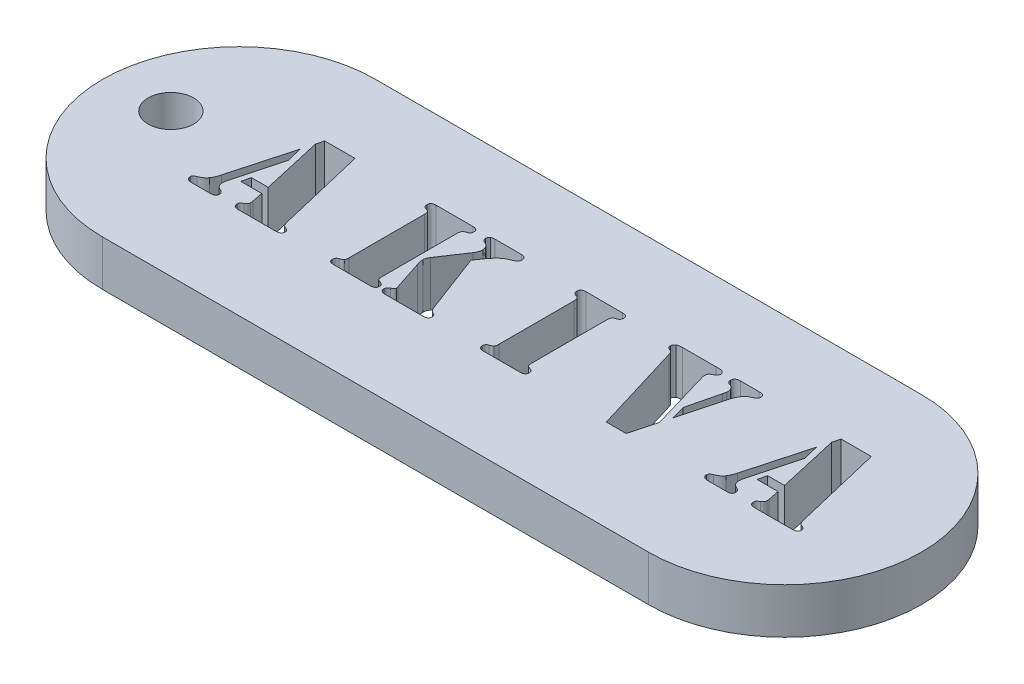
from build123d import *

# Parameters (mm, degrees)
BOSS_EXTRUDE1_DEPTH = 5
SKETCH3_R           = 2.5
CUT_EXTRUDE1_DEPTH  = 8


with BuildPart() as part:
    # Sketch2 → Boss-Extrude1 (new body)
    with BuildSketch(Plane(origin=(0, 0, 0), x_dir=(1, 0, 0), z_dir=(0, 1, 0))):
        with BuildLine():
            Line((-30, 15), (30, 15))
            ThreePointArc((30, 15), (45, 0), (30, -15))
            Line((30, -15), (-30, -15))
            ThreePointArc((-30, -15), (-45, 0), (-30, 15))
        make_face()
        with BuildLine():
            Line((-26.932759497, 6.350281331), (-23.601782799, 6.350281331))
            Line((-23.601782799, 6.350281331), (-21.287243843, -3.365883788))
            add(Edge.make_bspline(
                [(-21.287243843, -3.365883788), (-21.264912105, -3.446338159), (-21.222324973, -3.599766477), (-21.165071009, -3.748333014), (-21.137839741, -3.818994589)],
                knots=[0, 0, 0, 0, 1.048755183, 2, 2, 2, 2], degree=3))
            add(Edge.make_bspline(
                [(-21.137839741, -3.818994589), (-21.122803179, -3.845319978), (-21.091616737, -3.899919908), (-21.014786234, -3.96651677), (-20.919260528, -4.027819623), (-20.844542169, -4.059363279), (-20.804742071, -4.076165584)],
                knots=[0, 0, 0, 0, 0.840160251, 1.742526606, 2.797515595, 4, 4, 4, 4], degree=3))
            add(Edge.make_bspline(
                [(-20.804742071, -4.076165584), (-20.742307112, -4.103924345), (-20.635215601, -4.151537538), (-20.504379271, -4.245426776), (-20.429785901, -4.367373536), (-20.425127123, -4.45720289), (-20.42265945, -4.504783909)],
                knots=[0, 0, 0, 0, 1.326867952, 2.275909135, 3.086779591, 4, 4, 4, 4], degree=3))
            add(Edge.make_bspline(
                [(-20.42265945, -4.504783909), (-20.424147841, -4.53854973), (-20.427019146, -4.603688491), (-20.460199654, -4.694068209), (-20.513877044, -4.771238105), (-20.58953503, -4.833004371), (-20.686216982, -4.879449092), (-20.801972875, -4.913146059), (-20.938868308, -4.931690718), (-21.036548506, -4.934400457), (-21.08885479, -4.935851482)],
                knots=[0, 0, 0, 0, 0.899652897, 1.735550104, 2.535289427, 3.388132219, 4.315971308, 5.386976564, 6.600765056, 8, 8, 8, 8], degree=3))
            Line((-21.08885479, -4.935851482), (-25.213387701, -4.935851482))
            add(Edge.make_bspline(
                [(-25.213387701, -4.935851482), (-25.251926184, -4.934803734), (-25.326590656, -4.932773827), (-25.431223449, -4.907168495), (-25.525806297, -4.870562621), (-25.606142445, -4.817153812), (-25.67084155, -4.749945716), (-25.719122534, -4.672759288), (-25.74647422, -4.584099657), (-25.75026429, -4.52211072), (-25.752222167, -4.490088423)],
                knots=[0, 0, 0, 0, 1.175318829, 2.277063206, 3.273429624, 4.263211015, 5.198644873, 6.106027898, 7.021610334, 8, 8, 8, 8], degree=3))
            add(Edge.make_bspline(
                [(-25.752222167, -4.490088423), (-25.750675895, -4.440625607), (-25.747924115, -4.352600481), (-25.705101477, -4.249280975), (-25.646802067, -4.186049415), (-25.582902978, -4.138044978), (-25.503369054, -4.081071813), (-25.440774067, -4.046111818), (-25.406878259, -4.027180632)],
                knots=[0, 0, 0, 0, 1.432553572, 2.549404146, 3.155101411, 3.915709373, 4.871335893, 6, 6, 6, 6], degree=3))
            add(Edge.make_bspline(
                [(-25.406878259, -4.027180632), (-25.36117023, -3.999138049), (-25.278871784, -3.948646678), (-25.184031453, -3.846652831), (-25.130390411, -3.724202741), (-25.127014905, -3.635871359), (-25.125214789, -3.588765317)],
                knots=[0, 0, 0, 0, 1.161992046, 2.092195629, 2.982591342, 4, 4, 4, 4], degree=3))
            add(Edge.make_bspline(
                [(-25.125214789, -3.588765317), (-25.125558339, -3.543745341), (-25.126204688, -3.459045829), (-25.140541561, -3.375589809), (-25.147258017, -3.336492817)],
                knots=[0, 0, 0, 0, 1.063051602, 2, 2, 2, 2], degree=3))
            Line((-25.147258017, -3.336492817), (-25.387284279, -2.114318278))
            Line((-25.387284279, -2.114318278), (-27.692026244, -2.114318278))
            Line((-27.692026244, -2.114318278), (-27.469144715, -1.173807211))
            Line((-27.469144715, -1.173807211), (-25.617513551, -1.173807211))
            Line((-25.617513551, -1.173807211), (-27.138496293, 5.527334147))
            Line((-27.138496293, 5.527334147), (-26.932759497, 6.350281331))
        make_face(mode=Mode.SUBTRACT)
        with BuildLine():
            Line((-27.503434181, 4.219435943), (-27.082163599, 2.500064148))
            Line((-27.082163599, 2.500064148), (-28.510074933, -2.814803084))
            add(Edge.make_bspline(
                [(-28.510074933, -2.814803084), (-28.528006888, -2.887925643), (-28.562371161, -3.028055574), (-28.570072664, -3.172095235), (-28.57375537, -3.240972162)],
                knots=[0, 0, 0, 0, 1.043639418, 2, 2, 2, 2], degree=3))
            add(Edge.make_bspline(
                [(-28.57375537, -3.240972162), (-28.56957555, -3.321939343), (-28.561594048, -3.476548808), (-28.473000235, -3.687611761), (-28.333531468, -3.865267326), (-28.204654296, -3.941232252), (-28.137789302, -3.980644928)],
                knots=[0, 0, 0, 0, 1.065909191, 2.035388236, 2.980705811, 4, 4, 4, 4], degree=3))
            Line((-28.137789302, -3.980644928), (-27.87816906, -4.112904297))
            add(Edge.make_bspline(
                [(-27.87816906, -4.112904297), (-27.840653666, -4.135383715), (-27.769133931, -4.17823871), (-27.687944799, -4.275401643), (-27.640281262, -4.39376443), (-27.635643492, -4.479846386), (-27.633244303, -4.524377889)],
                knots=[0, 0, 0, 0, 1.03129857, 1.96607825, 2.947821365, 4, 4, 4, 4], degree=3))
            add(Edge.make_bspline(
                [(-27.633244303, -4.524377889), (-27.634019674, -4.556468693), (-27.635503415, -4.617877226), (-27.664299989, -4.702875402), (-27.706418856, -4.775674001), (-27.764374098, -4.83798969), (-27.843095127, -4.880505959), (-27.935653061, -4.912741016), (-28.044795454, -4.931759065), (-28.123019763, -4.934428218), (-28.164731026, -4.935851482)],
                knots=[0, 0, 0, 0, 1.001089615, 1.915671698, 2.776004461, 3.626767041, 4.544209435, 5.547912865, 6.692482548, 8, 8, 8, 8], degree=3))
            Line((-28.164731026, -4.935851482), (-30.263736195, -4.935851482))
            add(Edge.make_bspline(
                [(-30.263736195, -4.935851482), (-30.312031632, -4.934815469), (-30.404419622, -4.932833602), (-30.534629403, -4.907796179), (-30.650276143, -4.869145143), (-30.74800032, -4.813680898), (-30.827268554, -4.743127431), (-30.884766987, -4.659387596), (-30.917562969, -4.561734131), (-30.922481571, -4.49359474), (-30.92503304, -4.458248205)],
                knots=[0, 0, 0, 0, 1.263225168, 2.41651886, 3.457937625, 4.444571192, 5.337806274, 6.215550556, 7.074337118, 8, 8, 8, 8], degree=3))
            add(Edge.make_bspline(
                [(-30.92503304, -4.458248205), (-30.920791347, -4.418827189), (-30.912001376, -4.337135855), (-30.833831402, -4.227948373), (-30.715673113, -4.13328258), (-30.616973133, -4.086995438), (-30.562544399, -4.061470098)],
                knots=[0, 0, 0, 0, 0.824400861, 1.708388363, 2.736276122, 4, 4, 4, 4], degree=3))
            add(Edge.make_bspline(
                [(-30.562544399, -4.061470098), (-30.509287094, -4.038223603), (-30.409181942, -3.994528303), (-30.271987067, -3.927043972), (-30.158968154, -3.8603961), (-30.032933139, -3.776827473), (-29.892921545, -3.650782254), (-29.800571025, -3.531624339), (-29.751843452, -3.468752186)],
                knots=[0, 0, 0, 0, 1.026075952, 1.928664772, 2.697596979, 3.341335493, 4.597189607, 6, 6, 6, 6], degree=3))
            add(Edge.make_bspline(
                [(-29.751843452, -3.468752186), (-29.713826237, -3.408228115), (-29.634397542, -3.281776244), (-29.53609776, -3.068963651), (-29.443780307, -2.830667866), (-29.396771894, -2.659377334), (-29.372210079, -2.569878327)],
                knots=[0, 0, 0, 0, 0.874304226, 1.826668352, 2.864437965, 4, 4, 4, 4], degree=3))
            Line((-29.372210079, -2.569878327), (-27.503434181, 4.219435943))
        make_face(mode=Mode.SUBTRACT)
        with BuildLine():
            Line((-10.853449186, -4.935851482), (-14.473437097, -4.935851482))
            Line((-14.473437097, -4.935851482), (-14.688970884, -4.935851482))
            add(Edge.make_bspline(
                [(-14.688970884, -4.935851482), (-14.731515487, -4.934443732), (-14.811392739, -4.93180069), (-14.92450663, -4.912225517), (-15.023292968, -4.879306304), (-15.105425375, -4.829366005), (-15.172725841, -4.767496669), (-15.215450627, -4.689562893), (-15.244962721, -4.602384171), (-15.248157352, -4.540169409), (-15.249848578, -4.507233156)],
                knots=[0, 0, 0, 0, 1.275809178, 2.395324508, 3.433364274, 4.378530456, 5.262016052, 6.140052186, 7.015350866, 8, 8, 8, 8], degree=3))
            add(Edge.make_bspline(
                [(-15.249848578, -4.507233156), (-15.246516413, -4.455185075), (-15.240248732, -4.357284519), (-15.181452489, -4.223704961), (-15.078700262, -4.121673977), (-14.990348928, -4.083878345), (-14.943692631, -4.063919346)],
                knots=[0, 0, 0, 0, 1.074896783, 2.021841926, 2.955380476, 4, 4, 4, 4], degree=3))
            add(Edge.make_bspline(
                [(-14.943692631, -4.063919346), (-14.905266253, -4.05020047), (-14.838134408, -4.026233249), (-14.75122895, -3.993059596), (-14.690260802, -3.971887738), (-14.640863455, -3.952861388), (-14.595910537, -3.916921347), (-14.572571947, -3.879618242), (-14.559160762, -3.85818255)],
                knots=[0, 0, 0, 0, 1.641128884, 2.867093284, 3.73955991, 4.239698614, 4.988468111, 6, 6, 6, 6], degree=3))
            add(Edge.make_bspline(
                [(-14.559160762, -3.85818255), (-14.544151029, -3.83338624), (-14.511818215, -3.779971937), (-14.485087561, -3.682429401), (-14.467493446, -3.567403521), (-14.466582809, -3.484360446), (-14.466089355, -3.439361215)],
                knots=[0, 0, 0, 0, 0.795728394, 1.714096871, 2.761318972, 4, 4, 4, 4], degree=3))
            Line((-14.466089355, -3.439361215), (-14.466089355, 4.824400094))
            add(Edge.make_bspline(
                [(-14.466089355, 4.824400094), (-14.466687611, 4.870193444), (-14.467803752, 4.955628155), (-14.484375161, 5.073333731), (-14.512409304, 5.172859253), (-14.544205533, 5.227376465), (-14.559160762, 5.253018419)],
                knots=[0, 0, 0, 0, 1.234380862, 2.302932019, 3.201790819, 4, 4, 4, 4], degree=3))
            add(Edge.make_bspline(
                [(-14.559160762, 5.253018419), (-14.57257909, 5.274435277), (-14.595930109, 5.311705606), (-14.64081566, 5.347823287), (-14.690683303, 5.366430183), (-14.7505086, 5.391424213), (-14.838312083, 5.423050598), (-14.905330932, 5.447315304), (-14.943692631, 5.461204462)],
                knots=[0, 0, 0, 0, 1.009569614, 1.75688657, 2.256055053, 3.138468602, 4.362054748, 6, 6, 6, 6], degree=3))
            add(Edge.make_bspline(
                [(-14.943692631, 5.461204462), (-14.99061507, 5.480901737), (-15.080559028, 5.518658743), (-15.180770745, 5.626176002), (-15.240380664, 5.761842973), (-15.246562897, 5.861402318), (-15.249848578, 5.914315263)],
                knots=[0, 0, 0, 0, 1.03007389, 1.974512116, 2.923511095, 4, 4, 4, 4], degree=3))
            add(Edge.make_bspline(
                [(-15.249848578, 5.914315263), (-15.248117776, 5.948043574), (-15.244845526, 6.011810245), (-15.216033411, 6.100929695), (-15.172656336, 6.17941592), (-15.105503284, 6.24152326), (-15.022786177, 6.290708449), (-14.925090311, 6.327453181), (-14.811300401, 6.34597765), (-14.731483397, 6.348785696), (-14.688970884, 6.350281331)],
                knots=[0, 0, 0, 0, 1.002003185, 1.894384998, 2.766311233, 3.643649008, 4.582238159, 5.621343591, 6.733068665, 8, 8, 8, 8], degree=3))
            Line((-14.688970884, 6.350281331), (-14.473437097, 6.350281331))
            Line((-14.473437097, 6.350281331), (-10.853449186, 6.350281331))
            Line((-10.853449186, 6.350281331), (-10.637915399, 6.350281331))
            add(Edge.make_bspline(
                [(-10.637915399, 6.350281331), (-10.595419179, 6.348745631), (-10.515632767, 6.345862363), (-10.402397658, 6.327958499), (-10.306034447, 6.290052122), (-10.22361451, 6.241697072), (-10.157060784, 6.17869945), (-10.110340896, 6.101719298), (-10.08222507, 6.011698799), (-10.07883227, 5.94800502), (-10.077037705, 5.914315263)],
                knots=[0, 0, 0, 0, 1.268560657, 2.381715452, 3.39938894, 4.339185152, 5.217651218, 6.10317875, 6.996708201, 8, 8, 8, 8], degree=3))
            add(Edge.make_bspline(
                [(-10.077037705, 5.914315263), (-10.080323386, 5.861402318), (-10.086505619, 5.761842973), (-10.146115538, 5.626176002), (-10.246327255, 5.518658743), (-10.336271213, 5.480901737), (-10.383193652, 5.461204462)],
                knots=[0, 0, 0, 0, 1.076488905, 2.025487884, 2.96992611, 4, 4, 4, 4], degree=3))
            add(Edge.make_bspline(
                [(-10.383193652, 5.461204462), (-10.421574231, 5.447371774), (-10.488626064, 5.423205722), (-10.576960537, 5.390769731), (-10.637895021, 5.366716982), (-10.68813716, 5.348304953), (-10.730873655, 5.310629643), (-10.754151528, 5.274238901), (-10.767725521, 5.253018419)],
                knots=[0, 0, 0, 0, 1.636602956, 2.859186374, 3.771360974, 4.270120389, 4.991257728, 6, 6, 6, 6], degree=3))
            add(Edge.make_bspline(
                [(-10.767725521, 5.253018419), (-10.782939872, 5.227447102), (-10.815168271, 5.173279654), (-10.838458272, 5.072585895), (-10.860360232, 4.955997411), (-10.860644685, 4.870278196), (-10.860796928, 4.824400094)],
                knots=[0, 0, 0, 0, 0.798774196, 1.692034923, 2.764745377, 4, 4, 4, 4], degree=3))
            Line((-10.860796928, 4.824400094), (-10.860796928, -3.439361215))
            add(Edge.make_bspline(
                [(-10.860796928, -3.439361215), (-10.858776394, -3.508399346), (-10.855137632, -3.63272952), (-10.812152656, -3.795568896), (-10.742230404, -3.923962768), (-10.665058714, -3.963952172), (-10.628118409, -3.983094176)],
                knots=[0, 0, 0, 0, 1.316005662, 2.369983217, 3.219748642, 4, 4, 4, 4], degree=3))
            Line((-10.628118409, -3.983094176), (-10.380744404, -4.063919346))
            add(Edge.make_bspline(
                [(-10.380744404, -4.063919346), (-10.334865207, -4.082104519), (-10.246765133, -4.117024813), (-10.144768494, -4.219468451), (-10.086759891, -4.354971096), (-10.080411626, -4.454393168), (-10.077037705, -4.507233156)],
                knots=[0, 0, 0, 0, 1.013906066, 1.946965185, 2.908870689, 4, 4, 4, 4], degree=3))
            add(Edge.make_bspline(
                [(-10.077037705, -4.507233156), (-10.079214022, -4.540818808), (-10.083364234, -4.604866259), (-10.106540109, -4.695661709), (-10.152237241, -4.771592254), (-10.216325551, -4.832073036), (-10.297529087, -4.87937649), (-10.395717767, -4.912660699), (-10.5114579, -4.93182801), (-10.593750559, -4.934446298), (-10.637915399, -4.935851482)],
                knots=[0, 0, 0, 0, 1.003012501, 1.91273332, 2.764569601, 3.608364563, 4.51449415, 5.546348955, 6.6831741, 8, 8, 8, 8], degree=3))
            Line((-10.637915399, -4.935851482), (-10.853449186, -4.935851482))
        make_face(mode=Mode.SUBTRACT)
        with BuildLine():
            Line((-7.544515716, 3.034000118), (-5.090369648, -3.463853691))
            add(Edge.make_bspline(
                [(-5.090369648, -3.463853691), (-5.058787959, -3.541416103), (-5.00233032, -3.680072103), (-4.899256136, -3.860821228), (-4.768168686, -3.99217463), (-4.663558782, -4.044590041), (-4.610317124, -4.071267089)],
                knots=[0, 0, 0, 0, 1.258708271, 2.250155052, 3.109408929, 4, 4, 4, 4], degree=3))
            add(Edge.make_bspline(
                [(-4.610317124, -4.071267089), (-4.562088279, -4.094259972), (-4.485590001, -4.130730178), (-4.41570893, -4.178518761), (-4.389884843, -4.196178715)],
                knots=[0, 0, 0, 0, 1.260913243, 2, 2, 2, 2], degree=3))
            add(Edge.make_bspline(
                [(-4.389884843, -4.196178715), (-4.356451295, -4.238405824), (-4.286202734, -4.327130886), (-4.280308456, -4.440481828), (-4.277219454, -4.499885414)],
                knots=[0, 0, 0, 0, 0.951864276, 2, 2, 2, 2], degree=3))
            add(Edge.make_bspline(
                [(-4.277219454, -4.499885414), (-4.279348036, -4.53428136), (-4.283361667, -4.599138012), (-4.306602774, -4.690881957), (-4.353149781, -4.7667721), (-4.416535218, -4.830332213), (-4.498500014, -4.878471792), (-4.597286406, -4.91347716), (-4.713355776, -4.931496701), (-4.796406426, -4.934340208), (-4.840546396, -4.935851482)],
                knots=[0, 0, 0, 0, 1.017615502, 1.918805624, 2.762654006, 3.615417735, 4.546142055, 5.545586965, 6.695522332, 8, 8, 8, 8], degree=3))
            Line((-4.840546396, -4.935851482), (-8.999368774, -4.935851482))
            add(Edge.make_bspline(
                [(-8.999368774, -4.935851482), (-9.045264703, -4.934982162), (-9.13208865, -4.93333762), (-9.253472791, -4.906743203), (-9.361051572, -4.872332907), (-9.450741604, -4.817777298), (-9.522005312, -4.747575294), (-9.57139756, -4.662000837), (-9.602106656, -4.563160249), (-9.605171704, -4.492779242), (-9.606782171, -4.455798957)],
                knots=[0, 0, 0, 0, 1.250231286, 2.365133772, 3.380410458, 4.320978112, 5.203759294, 6.083155999, 6.992832878, 8, 8, 8, 8], degree=3))
            add(Edge.make_bspline(
                [(-9.606782171, -4.455798957), (-9.603096766, -4.413395304), (-9.595803522, -4.329480467), (-9.533078139, -4.214114835), (-9.43723077, -4.112283725), (-9.351386432, -4.066392937), (-9.30552472, -4.041876118)],
                knots=[0, 0, 0, 0, 0.935981156, 1.852262712, 2.85258702, 4, 4, 4, 4], degree=3))
            add(Edge.make_bspline(
                [(-9.30552472, -4.041876118), (-9.252815129, -4.015150024), (-9.16518646, -3.970718415), (-9.055885783, -3.901623862), (-8.993376495, -3.816631962), (-8.984441028, -3.753823965), (-8.979774793, -3.721024686)],
                knots=[0, 0, 0, 0, 1.470547215, 2.444756085, 3.187828267, 4, 4, 4, 4], degree=3))
            add(Edge.make_bspline(
                [(-8.979774793, -3.721024686), (-8.981170954, -3.707922364), (-8.984605111, -3.675694381), (-8.998574687, -3.618752607), (-9.017141813, -3.543116326), (-9.035644589, -3.487400612), (-9.045904477, -3.456505948)],
                knots=[0, 0, 0, 0, 0.578317608, 1.422496763, 2.570760565, 4, 4, 4, 4], degree=3))
            Line((-9.045904477, -3.456505948), (-10.086834696, -0.29697658))
            add(Edge.make_bspline(
                [(-10.086834696, -0.29697658), (-10.108932324, -0.227011929), (-10.151253651, -0.093015793), (-10.197850629, 0.10156986), (-10.22681403, 0.280188279), (-10.231540504, 0.393619534), (-10.23378955, 0.447594682)],
                knots=[0, 0, 0, 0, 1.155456698, 2.212927941, 3.149639312, 4, 4, 4, 4], degree=3))
            add(Edge.make_bspline(
                [(-10.23378955, 0.447594682), (-10.230531674, 0.49682467), (-10.223748259, 0.599329311), (-10.179684581, 0.754950194), (-10.106935398, 0.915529891), (-10.042390611, 1.019790972), (-10.008458773, 1.074602061)],
                knots=[0, 0, 0, 0, 0.87510462, 1.822106559, 2.855059728, 4, 4, 4, 4], degree=3))
            Line((-10.008458773, 1.074602061), (-8.147030618, 3.861845798))
            add(Edge.make_bspline(
                [(-8.147030618, 3.861845798), (-8.106735941, 3.926125016), (-8.02789037, 4.051901717), (-7.94414108, 4.255024915), (-7.893159908, 4.462667642), (-7.886046574, 4.602875783), (-7.882511881, 4.672546744)],
                knots=[0, 0, 0, 0, 1.050819245, 2.056163436, 3.03408633, 4, 4, 4, 4], degree=3))
            add(Edge.make_bspline(
                [(-7.882511881, 4.672546744), (-7.887128277, 4.747829428), (-7.896327707, 4.897850745), (-7.986871628, 5.102402152), (-8.114954737, 5.278926633), (-8.237060888, 5.348835511), (-8.29643472, 5.38282854)],
                knots=[0, 0, 0, 0, 1.038054289, 2.068606788, 3.060864536, 4, 4, 4, 4], degree=3))
            Line((-8.29643472, 5.38282854), (-8.568301201, 5.507740166))
            add(Edge.make_bspline(
                [(-8.568301201, 5.507740166), (-8.606282376, 5.528744766), (-8.678736164, 5.568813639), (-8.765541787, 5.657728327), (-8.812880049, 5.771499922), (-8.819562409, 5.852680801), (-8.823022948, 5.894721283)],
                knots=[0, 0, 0, 0, 1.057307922, 2.016945607, 2.973051763, 4, 4, 4, 4], degree=3))
            add(Edge.make_bspline(
                [(-8.823022948, 5.894721283), (-8.820546047, 5.93011621), (-8.815644338, 6.00016163), (-8.780267587, 6.09939382), (-8.722205676, 6.189398344), (-8.667663236, 6.235638308), (-8.63932938, 6.259659171)],
                knots=[0, 0, 0, 0, 1.001922249, 1.982771791, 2.952084756, 4, 4, 4, 4], degree=3))
            add(Edge.make_bspline(
                [(-8.63932938, 6.259659171), (-8.616100963, 6.273675032), (-8.565593085, 6.304151124), (-8.472781802, 6.331828946), (-8.361576578, 6.348646879), (-8.281003141, 6.349709576), (-8.237652779, 6.350281331)],
                knots=[0, 0, 0, 0, 0.776589291, 1.688615979, 2.756422232, 4, 4, 4, 4], degree=3))
            Line((-8.237652779, 6.350281331), (-5.296106444, 6.350281331))
            add(Edge.make_bspline(
                [(-5.296106444, 6.350281331), (-5.255136896, 6.349260379), (-5.177261114, 6.347319731), (-5.06692056, 6.322112301), (-4.970725293, 6.281353441), (-4.890179678, 6.223176274), (-4.82427118, 6.151779483), (-4.780698189, 6.063142982), (-4.752891055, 5.963334617), (-4.749330907, 5.892473498), (-4.747474988, 5.855533321)],
                knots=[0, 0, 0, 0, 1.171239978, 2.226317677, 3.221115542, 4.142585721, 5.053313005, 5.973595721, 6.943627567, 8, 8, 8, 8], degree=3))
            add(Edge.make_bspline(
                [(-4.747474988, 5.855533321), (-4.750968349, 5.800715313), (-4.757815689, 5.693266477), (-4.834914628, 5.547893379), (-4.957122194, 5.428424097), (-5.062986385, 5.379614056), (-5.119760619, 5.353437569)],
                knots=[0, 0, 0, 0, 0.97817598, 1.917323754, 2.88307513, 4, 4, 4, 4], degree=3))
            Line((-5.119760619, 5.353437569), (-5.548378944, 5.177091744))
            add(Edge.make_bspline(
                [(-5.548378944, 5.177091744), (-5.596175004, 5.155937754), (-5.701243951, 5.109435438), (-5.863144101, 5.01194407), (-6.040539926, 4.880886967), (-6.162031191, 4.780151037), (-6.226820522, 4.726430191)],
                knots=[0, 0, 0, 0, 0.76635461, 1.684659183, 2.765266103, 4, 4, 4, 4], degree=3))
            add(Edge.make_bspline(
                [(-6.226820522, 4.726430191), (-6.281408821, 4.674876932), (-6.401581397, 4.561385799), (-6.581825195, 4.358669576), (-6.779226777, 4.110301053), (-6.914041868, 3.927626926), (-6.986087269, 3.830005579)],
                knots=[0, 0, 0, 0, 0.765394839, 1.684966757, 2.762842512, 4, 4, 4, 4], degree=3))
            Line((-6.986087269, 3.830005579), (-7.544515716, 3.034000118))
        make_face(mode=Mode.SUBTRACT)
        with BuildLine():
            Line((5.605494499, -4.935851482), (1.985506588, -4.935851482))
            Line((1.985506588, -4.935851482), (1.769972801, -4.935851482))
            add(Edge.make_bspline(
                [(1.769972801, -4.935851482), (1.727428198, -4.934443732), (1.647550946, -4.93180069), (1.534437055, -4.912225517), (1.435650716, -4.879306304), (1.35351831, -4.829366005), (1.286217844, -4.767496669), (1.243493058, -4.689562893), (1.213980964, -4.602384171), (1.210786333, -4.540169409), (1.209095107, -4.507233156)],
                knots=[0, 0, 0, 0, 1.275809178, 2.395324508, 3.433364274, 4.378530456, 5.262016052, 6.140052186, 7.015350866, 8, 8, 8, 8], degree=3))
            add(Edge.make_bspline(
                [(1.209095107, -4.507233156), (1.212427272, -4.455185075), (1.218694953, -4.357284519), (1.277491196, -4.223704961), (1.380243423, -4.121673977), (1.468594757, -4.083878345), (1.515251054, -4.063919346)],
                knots=[0, 0, 0, 0, 1.074896783, 2.021841926, 2.955380476, 4, 4, 4, 4], degree=3))
            add(Edge.make_bspline(
                [(1.515251054, -4.063919346), (1.553677432, -4.05020047), (1.620809277, -4.026233249), (1.707714735, -3.993059596), (1.768682883, -3.971887738), (1.81808023, -3.952861388), (1.863033148, -3.916921347), (1.886371737, -3.879618242), (1.899782923, -3.85818255)],
                knots=[0, 0, 0, 0, 1.641128884, 2.867093284, 3.73955991, 4.239698614, 4.988468111, 6, 6, 6, 6], degree=3))
            add(Edge.make_bspline(
                [(1.899782923, -3.85818255), (1.914792656, -3.83338624), (1.94712547, -3.779971937), (1.973856124, -3.682429401), (1.991450239, -3.567403521), (1.992360876, -3.484360446), (1.99285433, -3.439361215)],
                knots=[0, 0, 0, 0, 0.795728394, 1.714096871, 2.761318972, 4, 4, 4, 4], degree=3))
            Line((1.99285433, -3.439361215), (1.99285433, 4.824400094))
            add(Edge.make_bspline(
                [(1.99285433, 4.824400094), (1.992256074, 4.870193444), (1.991139932, 4.955628155), (1.974568523, 5.073333731), (1.946534381, 5.172859253), (1.914738152, 5.227376465), (1.899782923, 5.253018419)],
                knots=[0, 0, 0, 0, 1.234380862, 2.302932019, 3.201790819, 4, 4, 4, 4], degree=3))
            add(Edge.make_bspline(
                [(1.899782923, 5.253018419), (1.886364595, 5.274435277), (1.863013575, 5.311705606), (1.818128025, 5.347823287), (1.768260382, 5.366430183), (1.708435085, 5.391424213), (1.620631602, 5.423050598), (1.553612752, 5.447315304), (1.515251054, 5.461204462)],
                knots=[0, 0, 0, 0, 1.009569614, 1.75688657, 2.256055053, 3.138468602, 4.362054748, 6, 6, 6, 6], degree=3))
            add(Edge.make_bspline(
                [(1.515251054, 5.461204462), (1.468328615, 5.480901737), (1.378384656, 5.518658743), (1.27817294, 5.626176002), (1.218563021, 5.761842973), (1.212380787, 5.861402318), (1.209095107, 5.914315263)],
                knots=[0, 0, 0, 0, 1.03007389, 1.974512116, 2.923511095, 4, 4, 4, 4], degree=3))
            add(Edge.make_bspline(
                [(1.209095107, 5.914315263), (1.210825909, 5.948043574), (1.214098159, 6.011810245), (1.242910274, 6.100929695), (1.286287349, 6.17941592), (1.353440401, 6.24152326), (1.436157508, 6.290708449), (1.533853374, 6.327453181), (1.647643284, 6.34597765), (1.727460287, 6.348785696), (1.769972801, 6.350281331)],
                knots=[0, 0, 0, 0, 1.002003185, 1.894384998, 2.766311233, 3.643649008, 4.582238159, 5.621343591, 6.733068665, 8, 8, 8, 8], degree=3))
            Line((1.769972801, 6.350281331), (1.985506588, 6.350281331))
            Line((1.985506588, 6.350281331), (5.605494499, 6.350281331))
            Line((5.605494499, 6.350281331), (5.821028286, 6.350281331))
            add(Edge.make_bspline(
                [(5.821028286, 6.350281331), (5.863524506, 6.348745631), (5.943310918, 6.345862363), (6.056546027, 6.327958499), (6.152909238, 6.290052122), (6.235329175, 6.241697072), (6.301882901, 6.17869945), (6.348602789, 6.101719298), (6.376718615, 6.011698799), (6.380111415, 5.94800502), (6.38190598, 5.914315263)],
                knots=[0, 0, 0, 0, 1.268560657, 2.381715452, 3.39938894, 4.339185152, 5.217651218, 6.10317875, 6.996708201, 8, 8, 8, 8], degree=3))
            add(Edge.make_bspline(
                [(6.38190598, 5.914315263), (6.378620299, 5.861402318), (6.372438066, 5.761842973), (6.312828147, 5.626176002), (6.21261643, 5.518658743), (6.122672472, 5.480901737), (6.075750033, 5.461204462)],
                knots=[0, 0, 0, 0, 1.076488905, 2.025487884, 2.96992611, 4, 4, 4, 4], degree=3))
            add(Edge.make_bspline(
                [(6.075750033, 5.461204462), (6.037369454, 5.447371774), (5.970317621, 5.423205722), (5.881983148, 5.390769731), (5.821048664, 5.366716982), (5.770806525, 5.348304953), (5.72807003, 5.310629643), (5.704792157, 5.274238901), (5.691218164, 5.253018419)],
                knots=[0, 0, 0, 0, 1.636602956, 2.859186374, 3.771360974, 4.270120389, 4.991257728, 6, 6, 6, 6], degree=3))
            add(Edge.make_bspline(
                [(5.691218164, 5.253018419), (5.676003813, 5.227447102), (5.643775414, 5.173279654), (5.620485413, 5.072585895), (5.598583453, 4.955997411), (5.598299, 4.870278196), (5.598146756, 4.824400094)],
                knots=[0, 0, 0, 0, 0.798774196, 1.692034923, 2.764745377, 4, 4, 4, 4], degree=3))
            Line((5.598146756, 4.824400094), (5.598146756, -3.439361215))
            add(Edge.make_bspline(
                [(5.598146756, -3.439361215), (5.598187792, -3.48444823), (5.598263639, -3.567785127), (5.621183229, -3.681679101), (5.643197354, -3.780388252), (5.675954681, -3.83345552), (5.691218164, -3.85818255)],
                knots=[0, 0, 0, 0, 1.239531227, 2.291096129, 3.203725438, 4, 4, 4, 4], degree=3))
            add(Edge.make_bspline(
                [(5.691218164, -3.85818255), (5.704785579, -3.879421096), (5.72805217, -3.915842815), (5.770848902, -3.953352717), (5.820642851, -3.972171346), (5.88266718, -3.992428933), (5.970152393, -4.026373012), (6.037309306, -4.050251348), (6.075750033, -4.063919346)],
                knots=[0, 0, 0, 0, 1.010634903, 1.733125261, 2.232820463, 3.135449138, 4.360326402, 6, 6, 6, 6], degree=3))
            add(Edge.make_bspline(
                [(6.075750033, -4.063919346), (6.122406329, -4.083878345), (6.210757664, -4.121673977), (6.313509891, -4.223704961), (6.372306133, -4.357284519), (6.378573815, -4.455185075), (6.38190598, -4.507233156)],
                knots=[0, 0, 0, 0, 1.044619524, 1.978158074, 2.925103217, 4, 4, 4, 4], degree=3))
            add(Edge.make_bspline(
                [(6.38190598, -4.507233156), (6.380153182, -4.540132232), (6.376842246, -4.602276768), (6.347997538, -4.690339788), (6.301951574, -4.766780767), (6.235248833, -4.829536087), (6.153432434, -4.878658135), (6.055943387, -4.912719113), (5.943407772, -4.931691113), (5.863558165, -4.934405651), (5.821028286, -4.935851482)],
                knots=[0, 0, 0, 0, 0.985947552, 1.862400454, 2.754162249, 3.638812863, 4.585225398, 5.601516872, 6.722508463, 8, 8, 8, 8], degree=3))
            Line((5.821028286, -4.935851482), (5.605494499, -4.935851482))
        make_face(mode=Mode.SUBTRACT)
        with BuildLine():
            Line((18.258307457, -2.057985584), (17.474548234, -4.935851482))
            Line((17.474548234, -4.935851482), (15.29961639, -4.935851482))
            Line((15.29961639, -4.935851482), (12.304186609, 4.944413225))
            add(Edge.make_bspline(
                [(12.304186609, 4.944413225), (12.283655881, 5.006825014), (12.249573862, 5.110431652), (12.187977363, 5.243439674), (12.098350129, 5.327393879), (12.030127522, 5.363337335), (11.993132167, 5.38282854)],
                knots=[0, 0, 0, 0, 1.414131913, 2.347528472, 3.103907466, 4, 4, 4, 4], degree=3))
            add(Edge.make_bspline(
                [(11.993132167, 5.38282854), (11.952231236, 5.400578852), (11.877174084, 5.433152385), (11.774976741, 5.480919791), (11.696715635, 5.529063859), (11.620431191, 5.590750193), (11.563883927, 5.702604538), (11.557993331, 5.799299952), (11.554716852, 5.853084074)],
                knots=[0, 0, 0, 0, 1.149926389, 2.110225819, 2.904600924, 3.516527036, 4.618637558, 6, 6, 6, 6], degree=3))
            add(Edge.make_bspline(
                [(11.554716852, 5.853084074), (11.557172005, 5.892808033), (11.562013138, 5.971136742), (11.612226624, 6.079688502), (11.6906672, 6.174026171), (11.760593248, 6.218983754), (11.797192362, 6.242514438)],
                knots=[0, 0, 0, 0, 0.983883633, 1.940046655, 2.921825721, 4, 4, 4, 4], degree=3))
            add(Edge.make_bspline(
                [(11.797192362, 6.242514438), (11.833496365, 6.259236597), (11.913423208, 6.296052078), (12.055380082, 6.327681613), (12.225282128, 6.34624938), (12.348206544, 6.348870063), (12.41440275, 6.350281331)],
                knots=[0, 0, 0, 0, 0.757141257, 1.666921088, 2.743610273, 4, 4, 4, 4], degree=3))
            Line((12.41440275, 6.350281331), (16.093172603, 6.350281331))
            add(Edge.make_bspline(
                [(16.093172603, 6.350281331), (16.150334555, 6.350863592), (16.254887416, 6.351928583), (16.396864103, 6.345431212), (16.509725592, 6.341977487), (16.617082777, 6.332700665), (16.723342408, 6.315666953), (16.794958249, 6.282352605), (16.827946875, 6.267006914)],
                knots=[0, 0, 0, 0, 1.379012105, 2.522301249, 3.429365328, 4.101773528, 5.125614089, 6, 6, 6, 6], degree=3))
            add(Edge.make_bspline(
                [(16.827946875, 6.267006914), (16.856292412, 6.245461852), (16.916082925, 6.200015887), (16.978461682, 6.104298543), (17.032611483, 6.003539278), (17.038330801, 5.929623618), (17.041031414, 5.894721283)],
                knots=[0, 0, 0, 0, 0.955691749, 2.015883481, 3.063117341, 4, 4, 4, 4], degree=3))
            add(Edge.make_bspline(
                [(17.041031414, 5.894721283), (17.037069044, 5.846489459), (17.029361912, 5.752674644), (16.958929028, 5.62468316), (16.846472785, 5.520932179), (16.749661308, 5.478753897), (16.698136753, 5.456305967)],
                knots=[0, 0, 0, 0, 0.967227212, 1.881335489, 2.8724142, 4, 4, 4, 4], degree=3))
            add(Edge.make_bspline(
                [(16.698136753, 5.456305967), (16.65861085, 5.439043225), (16.585565827, 5.407141175), (16.48788163, 5.352309678), (16.409551884, 5.29764723), (16.330641431, 5.221319693), (16.267675024, 5.092257377), (16.260966804, 4.979547489), (16.257272191, 4.917471501)],
                knots=[0, 0, 0, 0, 1.032305847, 1.907731344, 2.678187147, 3.314110591, 4.520722171, 6, 6, 6, 6], degree=3))
            add(Edge.make_bspline(
                [(16.257272191, 4.917471501), (16.258625364, 4.875715163), (16.261158623, 4.79754365), (16.275216151, 4.720624677), (16.281764666, 4.684792982)],
                knots=[0, 0, 0, 0, 1.068326202, 2, 2, 2, 2], degree=3))
            Line((16.281764666, 4.684792982), (18.258307457, -2.057985584))
        make_face(mode=Mode.SUBTRACT)
        with BuildLine():
            Line((18.574260394, -0.879897502), (18.135845078, 0.665577716))
            Line((18.135845078, 0.665577716), (18.990632481, 4.165552497))
            add(Edge.make_bspline(
                [(18.990632481, 4.165552497), (19.003076015, 4.215310256), (19.025274408, 4.30407462), (19.052059713, 4.421660606), (19.070719269, 4.507209239), (19.076563941, 4.554132397), (19.078805394, 4.572127594)],
                knots=[0, 0, 0, 0, 1.478414957, 2.637388917, 3.477433859, 4, 4, 4, 4], degree=3))
            add(Edge.make_bspline(
                [(19.078805394, 4.572127594), (19.078936979, 4.637190846), (19.079219145, 4.776710263), (19.032636556, 4.908416252), (19.007777214, 4.978702691)],
                knots=[0, 0, 0, 0, 0.932676655, 2, 2, 2, 2], degree=3))
            add(Edge.make_bspline(
                [(19.007777214, 4.978702691), (18.987139163, 5.023517668), (18.947425468, 5.109754897), (18.86740845, 5.222778848), (18.765475439, 5.306617505), (18.688623666, 5.342726021), (18.650187068, 5.360785312)],
                knots=[0, 0, 0, 0, 1.098119805, 2.113106297, 3.056290155, 4, 4, 4, 4], degree=3))
            Line((18.650187068, 5.360785312), (18.415059302, 5.461204462))
            add(Edge.make_bspline(
                [(18.415059302, 5.461204462), (18.373443397, 5.480764584), (18.292890497, 5.518625698), (18.199713028, 5.616775101), (18.146569027, 5.743870884), (18.141150357, 5.836239408), (18.138294326, 5.884924292)],
                knots=[0, 0, 0, 0, 1.012532981, 1.959886976, 2.924713082, 4, 4, 4, 4], degree=3))
            add(Edge.make_bspline(
                [(18.138294326, 5.884924292), (18.139800291, 5.920299495), (18.142706787, 5.988573244), (18.17601727, 6.084893421), (18.231036223, 6.167270297), (18.307006221, 6.235223622), (18.402618691, 6.285492518), (18.513534894, 6.325672232), (18.642094486, 6.34629812), (18.732586216, 6.348911902), (18.77999719, 6.350281331)],
                knots=[0, 0, 0, 0, 0.945506847, 1.824817721, 2.69315735, 3.576818582, 4.527381652, 5.57303541, 6.728450034, 8, 8, 8, 8], degree=3))
            Line((18.77999719, 6.350281331), (20.805524932, 6.350281331))
            add(Edge.make_bspline(
                [(20.805524932, 6.350281331), (20.857804719, 6.349181299), (20.952736925, 6.347183807), (21.080153181, 6.337399214), (21.178738322, 6.315157307), (21.229589585, 6.288274772), (21.25128799, 6.276803904)],
                knots=[0, 0, 0, 0, 1.373328899, 2.493758048, 3.357281503, 4, 4, 4, 4], degree=3))
            add(Edge.make_bspline(
                [(21.25128799, 6.276803904), (21.278740145, 6.255273134), (21.332694211, 6.212956874), (21.390249977, 6.126849763), (21.422824084, 6.026777002), (21.427586818, 5.956203011), (21.430083063, 5.919213758)],
                knots=[0, 0, 0, 0, 1.000744093, 1.966847859, 2.934383951, 4, 4, 4, 4], degree=3))
            add(Edge.make_bspline(
                [(21.430083063, 5.919213758), (21.428044905, 5.872248693), (21.424269725, 5.785257603), (21.375787681, 5.664732866), (21.279143645, 5.569790048), (21.195842796, 5.528689484), (21.148419592, 5.505290919)],
                knots=[0, 0, 0, 0, 1.044676578, 1.935003263, 2.824396593, 4, 4, 4, 4], degree=3))
            Line((21.148419592, 5.505290919), (20.736946, 5.304452618))
            add(Edge.make_bspline(
                [(20.736946, 5.304452618), (20.693576678, 5.28052131), (20.601409061, 5.229662975), (20.474642504, 5.119166793), (20.352832678, 4.977422357), (20.234730137, 4.809633424), (20.123537122, 4.621521021), (20.025675459, 4.416227909), (19.939038209, 4.198941861), (19.894795199, 4.046771349), (19.872361607, 3.969612691)],
                knots=[0, 0, 0, 0, 0.727412591, 1.545882683, 2.456927998, 3.473787573, 4.561842327, 5.668904702, 6.818008931, 8, 8, 8, 8], degree=3))
            Line((19.872361607, 3.969612691), (18.574260394, -0.879897502))
        make_face(mode=Mode.SUBTRACT)
        with BuildLine():
            Line((29.811408255, 6.350281331), (33.142384953, 6.350281331))
            Line((33.142384953, 6.350281331), (35.456923909, -3.365883788))
            add(Edge.make_bspline(
                [(35.456923909, -3.365883788), (35.479255647, -3.446338159), (35.521842779, -3.599766477), (35.579096743, -3.748333014), (35.606328011, -3.818994589)],
                knots=[0, 0, 0, 0, 1.048755183, 2, 2, 2, 2], degree=3))
            add(Edge.make_bspline(
                [(35.606328011, -3.818994589), (35.621364572, -3.845319978), (35.652551014, -3.899919908), (35.729381518, -3.96651677), (35.824907224, -4.027819623), (35.899625583, -4.059363279), (35.93942568, -4.076165584)],
                knots=[0, 0, 0, 0, 0.840160251, 1.742526606, 2.797515595, 4, 4, 4, 4], degree=3))
            add(Edge.make_bspline(
                [(35.93942568, -4.076165584), (36.001860639, -4.103924345), (36.10895215, -4.151537538), (36.23978848, -4.245426776), (36.31438185, -4.367373536), (36.319040629, -4.45720289), (36.321508302, -4.504783909)],
                knots=[0, 0, 0, 0, 1.326867952, 2.275909135, 3.086779591, 4, 4, 4, 4], degree=3))
            add(Edge.make_bspline(
                [(36.321508302, -4.504783909), (36.32001991, -4.53854973), (36.317148606, -4.603688491), (36.283968098, -4.694068209), (36.230290708, -4.771238105), (36.154632722, -4.833004371), (36.057950769, -4.879449092), (35.942194877, -4.913146059), (35.805299444, -4.931690718), (35.707619246, -4.934400457), (35.655312962, -4.935851482)],
                knots=[0, 0, 0, 0, 0.899652897, 1.735550104, 2.535289427, 3.388132219, 4.315971308, 5.386976564, 6.600765056, 8, 8, 8, 8], degree=3))
            Line((35.655312962, -4.935851482), (31.53078005, -4.935851482))
            add(Edge.make_bspline(
                [(31.53078005, -4.935851482), (31.492241568, -4.934803734), (31.417577095, -4.932773827), (31.312944303, -4.907168495), (31.218361454, -4.870562621), (31.138025306, -4.817153812), (31.073326202, -4.749945716), (31.025045217, -4.672759288), (30.997693531, -4.584099657), (30.993903462, -4.52211072), (30.991945585, -4.490088423)],
                knots=[0, 0, 0, 0, 1.175318829, 2.277063206, 3.273429624, 4.263211015, 5.198644873, 6.106027898, 7.021610334, 8, 8, 8, 8], degree=3))
            add(Edge.make_bspline(
                [(30.991945585, -4.490088423), (30.993491857, -4.440625607), (30.996243636, -4.352600481), (31.039066275, -4.249280975), (31.097365685, -4.186049415), (31.161264773, -4.138044978), (31.240798698, -4.081071813), (31.303393685, -4.046111818), (31.337289492, -4.027180632)],
                knots=[0, 0, 0, 0, 1.432553572, 2.549404146, 3.155101411, 3.915709373, 4.871335893, 6, 6, 6, 6], degree=3))
            add(Edge.make_bspline(
                [(31.337289492, -4.027180632), (31.382997522, -3.999138049), (31.465295967, -3.948646678), (31.560136299, -3.846652831), (31.61377734, -3.724202741), (31.617152847, -3.635871359), (31.618952963, -3.588765317)],
                knots=[0, 0, 0, 0, 1.161992046, 2.092195629, 2.982591342, 4, 4, 4, 4], degree=3))
            add(Edge.make_bspline(
                [(31.618952963, -3.588765317), (31.618609412, -3.543745341), (31.617963064, -3.459045829), (31.60362619, -3.375589809), (31.596909735, -3.336492817)],
                knots=[0, 0, 0, 0, 1.063051602, 2, 2, 2, 2], degree=3))
            Line((31.596909735, -3.336492817), (31.356883473, -2.114318278))
            Line((31.356883473, -2.114318278), (29.052141507, -2.114318278))
            Line((29.052141507, -2.114318278), (29.275023037, -1.173807211))
            Line((29.275023037, -1.173807211), (31.126654201, -1.173807211))
            Line((31.126654201, -1.173807211), (29.605671459, 5.527334147))
            Line((29.605671459, 5.527334147), (29.811408255, 6.350281331))
        make_face(mode=Mode.SUBTRACT)
        with BuildLine():
            Line((29.240733571, 4.219435943), (29.662004153, 2.500064148))
            Line((29.662004153, 2.500064148), (28.234092818, -2.814803084))
            add(Edge.make_bspline(
                [(28.234092818, -2.814803084), (28.216160864, -2.887925643), (28.181796591, -3.028055574), (28.174095088, -3.172095235), (28.170412381, -3.240972162)],
                knots=[0, 0, 0, 0, 1.043639418, 2, 2, 2, 2], degree=3))
            add(Edge.make_bspline(
                [(28.170412381, -3.240972162), (28.174592202, -3.321939343), (28.182573704, -3.476548808), (28.271167517, -3.687611761), (28.410636283, -3.865267326), (28.539513456, -3.941232252), (28.606378449, -3.980644928)],
                knots=[0, 0, 0, 0, 1.065909191, 2.035388236, 2.980705811, 4, 4, 4, 4], degree=3))
            Line((28.606378449, -3.980644928), (28.865998692, -4.112904297))
            add(Edge.make_bspline(
                [(28.865998692, -4.112904297), (28.903514086, -4.135383715), (28.975033821, -4.17823871), (29.056222953, -4.275401643), (29.103886489, -4.39376443), (29.10852426, -4.479846386), (29.110923449, -4.524377889)],
                knots=[0, 0, 0, 0, 1.03129857, 1.96607825, 2.947821365, 4, 4, 4, 4], degree=3))
            add(Edge.make_bspline(
                [(29.110923449, -4.524377889), (29.110148078, -4.556468693), (29.108664337, -4.617877226), (29.079867763, -4.702875402), (29.037748895, -4.775674001), (28.979793653, -4.83798969), (28.901072625, -4.880505959), (28.808514691, -4.912741016), (28.699372298, -4.931759065), (28.621147988, -4.934428218), (28.579436726, -4.935851482)],
                knots=[0, 0, 0, 0, 1.001089615, 1.915671698, 2.776004461, 3.626767041, 4.544209435, 5.547912865, 6.692482548, 8, 8, 8, 8], degree=3))
            Line((28.579436726, -4.935851482), (26.480431557, -4.935851482))
            add(Edge.make_bspline(
                [(26.480431557, -4.935851482), (26.43213612, -4.934815469), (26.33974813, -4.932833602), (26.209538349, -4.907796179), (26.093891609, -4.869145143), (25.996167432, -4.813680898), (25.916899197, -4.743127431), (25.859400765, -4.659387596), (25.826604783, -4.561734131), (25.821686181, -4.49359474), (25.819134712, -4.458248205)],
                knots=[0, 0, 0, 0, 1.263225168, 2.41651886, 3.457937625, 4.444571192, 5.337806274, 6.215550556, 7.074337118, 8, 8, 8, 8], degree=3))
            add(Edge.make_bspline(
                [(25.819134712, -4.458248205), (25.823376405, -4.418827189), (25.832166375, -4.337135855), (25.91033635, -4.227948373), (26.028494638, -4.13328258), (26.127194618, -4.086995438), (26.181623353, -4.061470098)],
                knots=[0, 0, 0, 0, 0.824400861, 1.708388363, 2.736276122, 4, 4, 4, 4], degree=3))
            add(Edge.make_bspline(
                [(26.181623353, -4.061470098), (26.234880658, -4.038223603), (26.334985809, -3.994528303), (26.472180685, -3.927043972), (26.585199597, -3.8603961), (26.711234613, -3.776827473), (26.851246207, -3.650782254), (26.943596726, -3.531624339), (26.992324299, -3.468752186)],
                knots=[0, 0, 0, 0, 1.026075952, 1.928664772, 2.697596979, 3.341335493, 4.597189607, 6, 6, 6, 6], degree=3))
            add(Edge.make_bspline(
                [(26.992324299, -3.468752186), (27.030341515, -3.408228115), (27.10977021, -3.281776244), (27.208069992, -3.068963651), (27.300387444, -2.830667866), (27.347395858, -2.659377334), (27.371957673, -2.569878327)],
                knots=[0, 0, 0, 0, 0.874304226, 1.826668352, 2.864437965, 4, 4, 4, 4], degree=3))
            Line((27.371957673, -2.569878327), (29.240733571, 4.219435943))
        make_face(mode=Mode.SUBTRACT)
    extrude(amount=BOSS_EXTRUDE1_DEPTH)

    # Sketch3 → Cut-Extrude1 (cut)
    with BuildSketch(Plane(origin=(0, 5, 0), x_dir=(1, 0, 0), z_dir=(0, 1, 0))):
        with Locations(Location((-38.231741102, 0.741302984, 0), (0, 0, 270))):
            Circle(SKETCH3_R)
    extrude(amount=-CUT_EXTRUDE1_DEPTH, mode=Mode.SUBTRACT)


solid = part.part
